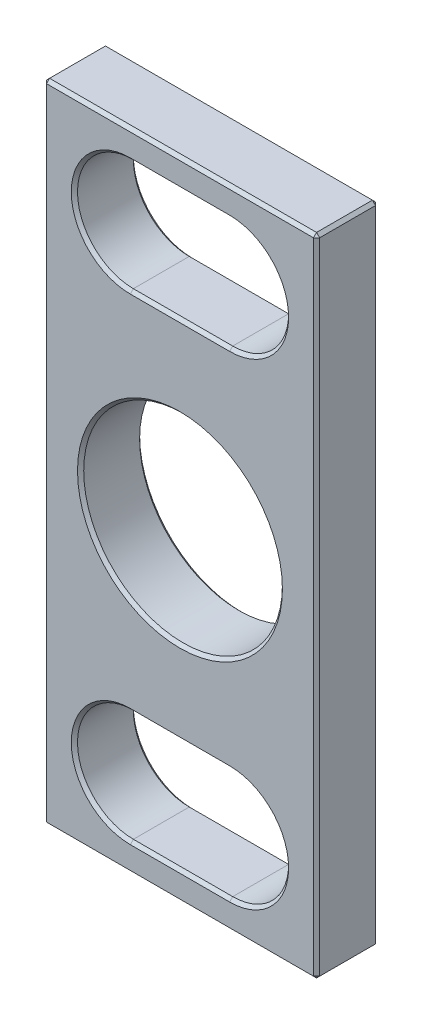
from build123d import *

# Parameters (mm, degrees)
ESQUISSE1_W             = 22
ESQUISSE1_H             = 52
BOSS_EXTRU_1_DEPTH      = 5
ESQUISSE5_R             = 8
ENL_V_MAT_EXTRU_2_DEPTH = 5
ENL_V_MAT_EXTRU_3_DEPTH = 57.683330883
CHANFREIN1_SIZE         = 0.25


with BuildPart() as part:
    # Esquisse1 → Boss.-Extru.1 (new body)
    with BuildSketch(Plane.XY):
        with Locations((11, 26)):
            Rectangle(ESQUISSE1_W, ESQUISSE1_H)
    extrude(amount=BOSS_EXTRU_1_DEPTH)

    # Esquisse5 → Enlèv. mat.-Extru.2 (cut)
    with BuildSketch(Plane.XY.offset(5)):
        with Locations((11, 26)):
            Circle(ESQUISSE5_R)
    extrude(amount=-ENL_V_MAT_EXTRU_2_DEPTH, mode=Mode.SUBTRACT)

    # Esquisse6 → Enlèv. mat.-Extru.3 (cut, through all)
    with BuildSketch(Plane.XY.offset(5)):
        with BuildLine():
            Line((7, 49.7), (15, 49.7))
            ThreePointArc((15, 49.7), (19.5, 45.2), (15, 40.7))
            Line((15, 40.7), (7, 40.7))
            ThreePointArc((7, 40.7), (2.5, 45.2), (7, 49.7))
        make_face()
        with BuildLine():
            Line((7, 2.3), (15, 2.3))
            ThreePointArc((15, 2.3), (19.5, 6.8), (15, 11.3))
            Line((15, 11.3), (7, 11.3))
            ThreePointArc((7, 11.3), (2.5, 6.8), (7, 2.3))
        make_face()
    extrude(amount=-ENL_V_MAT_EXTRU_3_DEPTH, mode=Mode.SUBTRACT)

    # Chanfrein1
    chanfrein1_edges = [part.edges().sort_by_distance(p)[0] for p in [
        (22, 26, 5),
        (11, 52, 5),
        (3, 26, 0),
        (3, 26, 5),
        (2.5, 45.2, 0),
        (11, 49.7, 0),
        (19.5, 45.2, 0),
        (11, 40.7, 0),
        (2.5, 45.2, 5),
        (11, 40.7, 5),
        (19.5, 45.2, 5),
        (11, 49.7, 5),
        (2.5, 6.8, 0),
        (11, 11.3, 0),
        (19.5, 6.8, 0),
        (11, 2.3, 0),
        (2.5, 6.8, 5),
        (11, 2.3, 5),
        (19.5, 6.8, 5),
        (11, 11.3, 5),
        (0, 26, 5),
        (11, 52, 0),
        (22, 26, 0),
        (11, 0, 0),
        (0, 26, 0),
        (11, 0, 5),
        (0, 52, 2.5),
        (22, 52, 2.5),
        (22, 0, 2.5),
        (0, 0, 2.5),
    ]]
    chamfer(chanfrein1_edges, length=CHANFREIN1_SIZE)


solid = part.part
